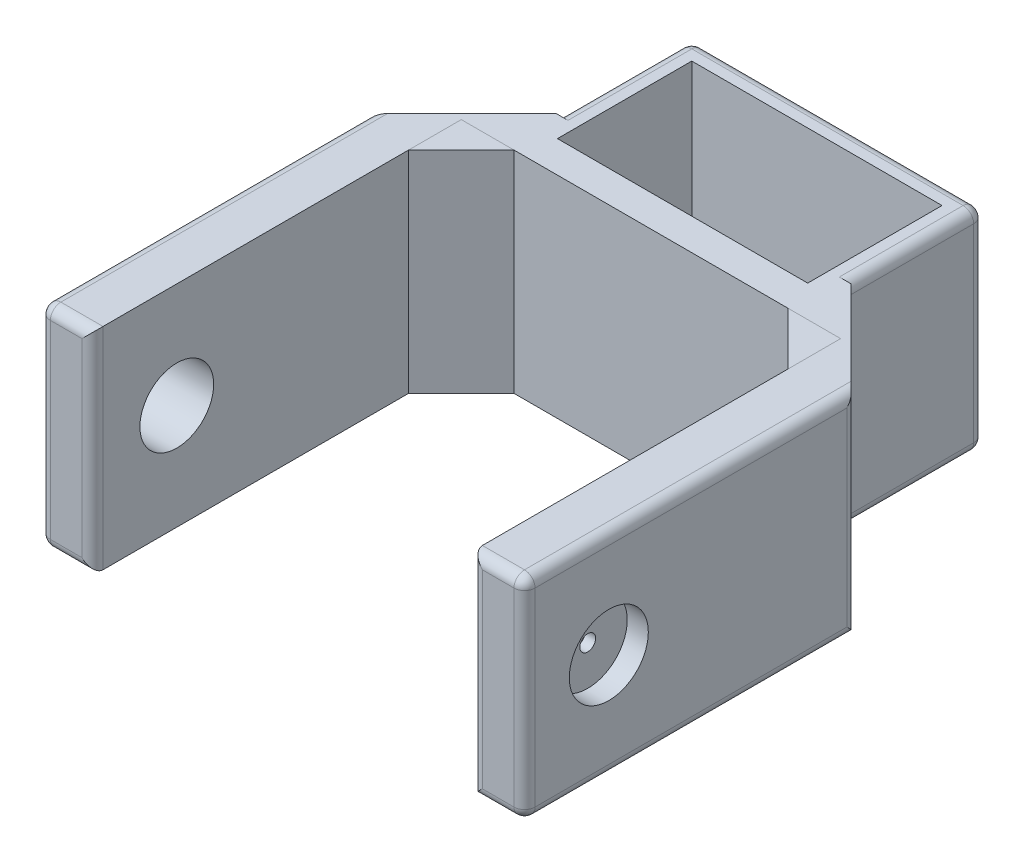
from build123d import *

# Parameters (mm, degrees)
BOSS_EXTRUDE1_DEPTH      = 20
SKETCH6_R                = 3.5
CUT_EXTRUDE1_DEPTH       = 51.289163843
CUT_EXTRUDE5_DEPTH       = 20
CUT_EXTRUDE5_DEPTH_BACK  = 0.0001
SKETCH9_W                = 27.75
SKETCH9_H                = 12.75
BOSS_EXTRUDE2_DEPTH      = 20
SKETCH10_W               = 23.75
SKETCH10_H               = 12.75
CUT_EXTRUDE7_DEPTH       = 18
BOSS_EXTRUDE3_DEPTH      = 0.001
BOSS_EXTRUDE3_DEPTH_BACK = 7
SKETCH11_R               = 3
CUT_EXTRUDE8_REACH       = 66.156
SKETCH14_W               = 10
SKETCH14_H               = 5
SKETCH15_R               = 3.75
CUT_EXTRUDE9_DEPTH       = 2
CUT_EXTRUDE10_DEPTH      = 65.156059729
CUT_EXTRUDE10_DEPTH_BACK = 65.156059729
SKETCH16_R               = 0.75
BOSS_EXTRUDE4_DEPTH      = 20
BOSS_EXTRUDE4_2_DEPTH    = 20
CHAMFER1_SIZE            = 9
FILLET3_R                = 1


with BuildPart() as part:
    # Sketch2 → Boss-Extrude1 (new body)
    with BuildSketch(Plane(origin=(0, 0, 0), x_dir=(1, 0, 0), z_dir=(0, 1, 0))):
        Polygon((-23, 0), (23, 0), (23, -40), (18, -40), (18, -5), (-18, -5), (-18, -40), (-23, -40), align=None)
    extrude(amount=BOSS_EXTRUDE1_DEPTH)

    # Sketch6 → Cut-Extrude1 (cut, through all)
    with BuildSketch(Plane(origin=(0, 0, 0), x_dir=(0, 0, -1), z_dir=(1, 0, 0))):
        with Locations((-32, 10)):
            Circle(SKETCH6_R)
    extrude(amount=-CUT_EXTRUDE1_DEPTH, mode=Mode.SUBTRACT)

    # Sketch7 → Cut-Extrude5 (cut, two sides: drawn at the far end of the back side and taken through both)
    with BuildSketch(Plane(origin=(0, 0, 0), x_dir=(0, 0, -1), z_dir=(1, 0, 0)).offset(-CUT_EXTRUDE5_DEPTH_BACK)):
        with BuildLine():
            Line((-32, 14.25), (-17, 12.5))
            ThreePointArc((-17, 12.5), (-14.75, 10.25), (-17, 8))
            Line((-17, 8), (-32, 6.25))
            ThreePointArc((-32, 6.25), (-36, 10.25), (-32, 14.25))
        make_face()
    extrude(amount=CUT_EXTRUDE5_DEPTH + CUT_EXTRUDE5_DEPTH_BACK, mode=Mode.SUBTRACT)

    # Sketch9 → Boss-Extrude2 (add)
    with BuildSketch(Plane(origin=(0, 0, 0), x_dir=(1, 0, 0), z_dir=(0, 1, 0))):
        with Locations((0, 6.375)):
            Rectangle(SKETCH9_W, SKETCH9_H)
    extrude(amount=BOSS_EXTRUDE2_DEPTH)

    # Sketch10 → Cut-Extrude7 (cut)
    with BuildSketch(Plane(origin=(0, 20, 0), x_dir=(1, 0, 0), z_dir=(0, 1, 0))):
        with Locations((0, 4.375)):
            Rectangle(SKETCH10_W, SKETCH10_H)
    extrude(amount=-CUT_EXTRUDE7_DEPTH, mode=Mode.SUBTRACT)

    # Sketch11 → Boss-Extrude3 (add, two sides: drawn at the far end of the back side and taken through both)
    with BuildSketch(Plane(origin=(0, 0, 0), x_dir=(1, 0, 0), z_dir=(0, 1, 0)).offset(-BOSS_EXTRUDE3_DEPTH_BACK)):
        with Locations(Location((-5.375, 4.375, 0), (0, 0, 270))):
            Circle(SKETCH11_R)
    extrude(amount=BOSS_EXTRUDE3_DEPTH + BOSS_EXTRUDE3_DEPTH_BACK)

    # Cut-Extrude8: up to this face of the body (flat: up to its plane)
    cut_extrude8_end = Plane(part.part.faces().sort_by_distance((-11.875, 11, -4.375))[0])
    # Sketch14 → Cut-Extrude8 (cut, up to the picked face)
    with BuildSketch(Plane.ZY.offset(23), mode=Mode.PRIVATE) as cut_extrude8_sk1:
        with Locations((-4.75, 4.5)):
            Rectangle(SKETCH14_W, SKETCH14_H)
    cut_extrude8_tool1 = split(extrude(cut_extrude8_sk1.sketch, amount=-CUT_EXTRUDE8_REACH, mode=Mode.PRIVATE), bisect_by=cut_extrude8_end, keep=Keep.BOTH, mode=Mode.PRIVATE)
    add(cut_extrude8_tool1.solids().sort_by(Axis((-23, 4.5, -4.75), (1, 0, 0)))[0], mode=Mode.SUBTRACT)

    # Sketch15 → Cut-Extrude9 (cut)
    with BuildSketch(Plane(origin=(23, 0, 0), x_dir=(0, 0, -1), z_dir=(1, 0, 0))):
        with Locations((-32, 10)):
            Circle(SKETCH15_R)
    extrude(amount=-CUT_EXTRUDE9_DEPTH, mode=Mode.SUBTRACT)

    # Sketch16 → Cut-Extrude10 (cut, two sides: drawn at the far end of the back side and taken through both)
    with BuildSketch(Plane(origin=(23, 0, 0), x_dir=(0, 0, -1), z_dir=(1, 0, 0)).offset(-CUT_EXTRUDE10_DEPTH_BACK)):
        with Locations((-32, 10)):
            Circle(SKETCH16_R)
    extrude(amount=CUT_EXTRUDE10_DEPTH + CUT_EXTRUDE10_DEPTH_BACK, mode=Mode.SUBTRACT)

    # Chamfer1
    chamfer1_edges = [part.edges().sort_by_distance(p)[0] for p in [
        (-23, 13.5, 0),
        (23, 10, 0),
    ]]
    chamfer(chamfer1_edges, length=CHAMFER1_SIZE)

    # Fillet3
    fillet3_edges = [part.edges().sort_by_distance(p)[0] for p in [
        (-20.5, 0, 40),
        (-23, 0, 24.5),
        (23, 10, 9),
        (23, 0, 24.5),
        (-23, 20, 24.5),
        (-23, 10, 9),
        (23, 10, 40),
        (18, 10, 40),
        (-18, 10, 40),
        (-23, 10, 40),
        (-20.5, 20, 40),
        (20.5, 20, 40),
        (-13.875, 0, -6.375),
        (23, 20, 24.5),
        (-13.875, 10, -12.75),
        (13.875, 0, -6.375),
        (0, 0, -12.75),
        (13.875, 10, -12.75),
        (-13.875, 20, -6.375),
        (13.875, 20, -6.375),
        (0, 20, -12.75),
        (20.5, 0, 40),
    ]]
    fillet(fillet3_edges, radius=FILLET3_R)


with BuildPart() as body_2:
    # Sketch18 → Boss-Extrude4 (new body)
    with BuildSketch(Plane(origin=(0, 20, 0), x_dir=(-1, 0, 0), z_dir=(0, -1, 0))):
        Polygon((18, -5), (13, -5), (18, -10), align=None)
    extrude(amount=BOSS_EXTRUDE4_DEPTH)


with BuildPart() as body_3:
    # Sketch18 → Boss-Extrude4 2 (new body)
    with BuildSketch(Plane(origin=(0, 20, 0), x_dir=(-1, 0, 0), z_dir=(0, -1, 0))):
        Polygon((-18, -5), (-18, -10), (-13, -5), align=None)
    extrude(amount=BOSS_EXTRUDE4_2_DEPTH)


solid = Compound([part.part, body_2.part, body_3.part])
